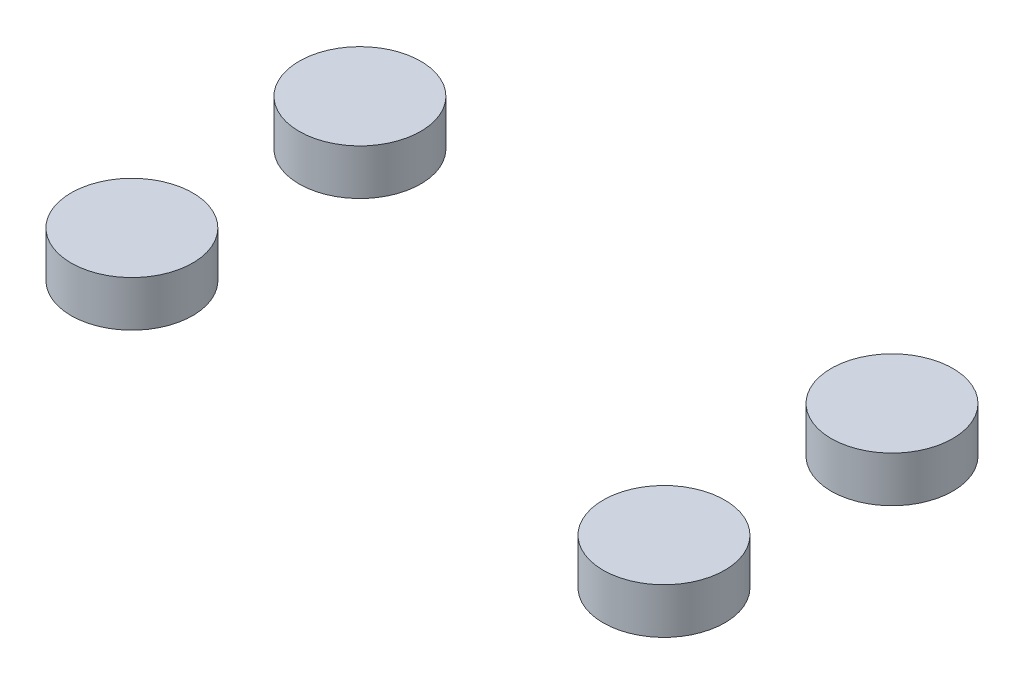
from build123d import *

# Parameters (mm, degrees)
BOSS_EXTRUDE1_START = -140
SKETCH1_R           = 160
BOSS_EXTRUDE1_DEPTH = 120
BOSS_EXTRUDE2_START = -140
SKETCH2_R           = 160
BOSS_EXTRUDE2_DEPTH = 120
BOSS_EXTRUDE3_START = -140
SKETCH3_R           = 160
BOSS_EXTRUDE3_DEPTH = 120
BOSS_EXTRUDE4_START = -140
SKETCH4_R           = 160
BOSS_EXTRUDE4_DEPTH = 120


with BuildPart() as part:
    # Sketch1 → Boss-Extrude1 (new body)
    with BuildSketch(Plane(origin=(0, 0, 0), x_dir=(1, 0, 0), z_dir=(0, 1, 0)).offset(BOSS_EXTRUDE1_START)):
        with Locations(Location((-700, 1940, 0), (0, 0, 270))):
            Circle(SKETCH1_R)
    extrude(amount=BOSS_EXTRUDE1_DEPTH)


with BuildPart() as body_2:
    # Sketch2 → Boss-Extrude2 (new body)
    with BuildSketch(Plane(origin=(0, 0, 0), x_dir=(1, 0, 0), z_dir=(0, 1, 0)).offset(BOSS_EXTRUDE2_START)):
        with Locations(Location((-700, 1340, 0), (0, 0, 270))):
            Circle(SKETCH2_R)
    extrude(amount=BOSS_EXTRUDE2_DEPTH)


with BuildPart() as body_3:
    # Sketch3 → Boss-Extrude3 (new body)
    with BuildSketch(Plane(origin=(0, 0, 0), x_dir=(1, 0, 0), z_dir=(0, 1, 0)).offset(BOSS_EXTRUDE3_START)):
        with Locations(Location((700, 1940, 0), (0, 0, 270))):
            Circle(SKETCH3_R)
    extrude(amount=BOSS_EXTRUDE3_DEPTH)


with BuildPart() as body_4:
    # Sketch4 → Boss-Extrude4 (new body)
    with BuildSketch(Plane(origin=(0, 0, 0), x_dir=(1, 0, 0), z_dir=(0, 1, 0)).offset(BOSS_EXTRUDE4_START)):
        with Locations(Location((700, 1340, 0), (0, 0, 270))):
            Circle(SKETCH4_R)
    extrude(amount=BOSS_EXTRUDE4_DEPTH)


solid = Compound([part.part, body_2.part, body_3.part, body_4.part])
